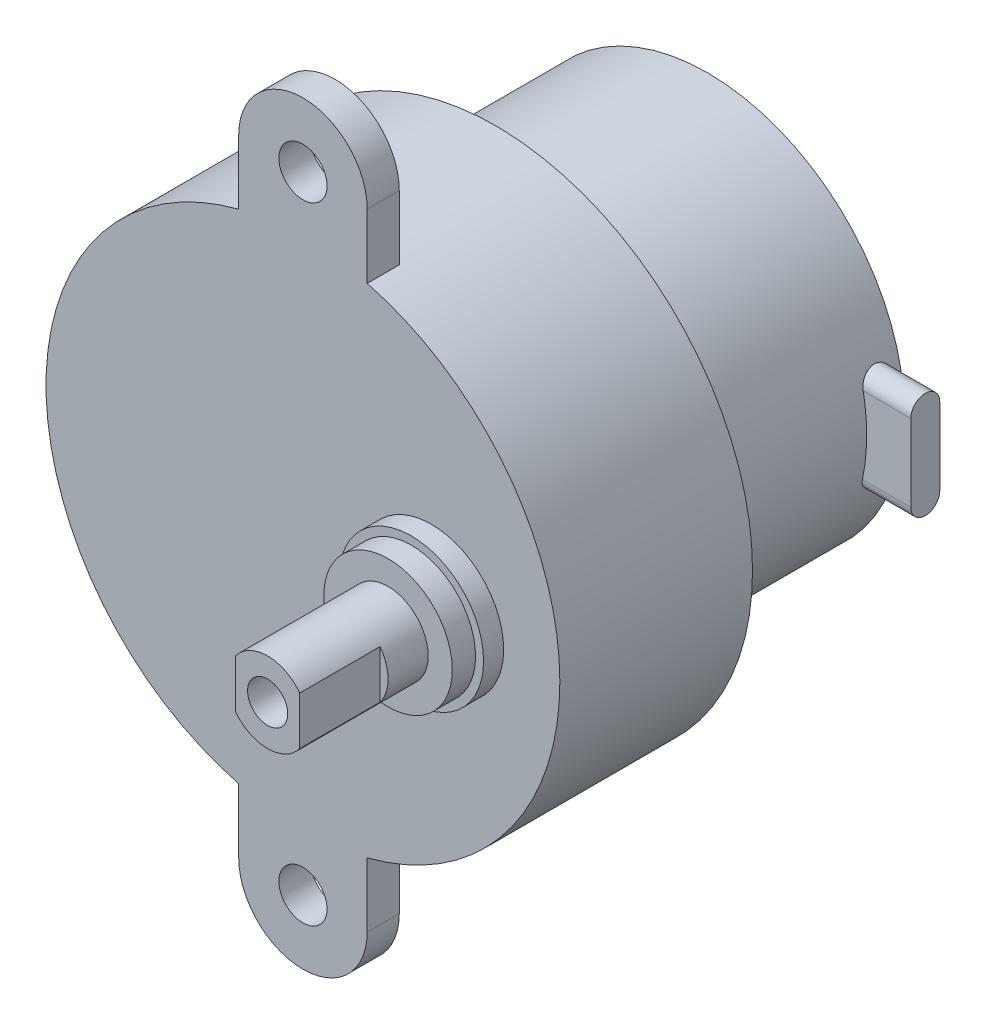
from build123d import *

# Parameters (mm, degrees)
SKETCH_1_R             = 16
EXTRUDE_1_DEPTH        = 12
SKETCH_2_R             = 13
EXTRUDE_2_DEPTH        = 2
SKETCH_3_R             = 12.25
EXTRUDE_4_DEPTH        = 11.2
SKETCH_4_R             = 1.5
EXTRUDE_5_DEPTH        = 2
SKETCH_21_W            = 0.599041837
SKETCH_21_H            = 5.051087673
CUT_EXTRUDE_2_DEPTH    = 5
HOLE_WIZARD_M3_1_D     = 2.5
HOLE_WIZARD_M3_1_DEPTH = 7.5
HOLE_WIZARD_M3_1_TIP   = 0.751075774
EXTRUDE_16_DEPTH       = 15


with BuildPart() as part:
    # 草图1 → 凸台-拉伸1 (new body)
    with BuildSketch(Plane.XY):
        Circle(SKETCH_1_R)
    extrude(amount=-EXTRUDE_1_DEPTH)

    # 草图2 → 凸台-拉伸2 (add)
    with BuildSketch(Plane(origin=(0, 0, -12), x_dir=(-1, 0, 0), z_dir=(0, 0, -1))):
        Circle(SKETCH_2_R)
    extrude(amount=EXTRUDE_2_DEPTH)

    # 草图3 → 凸台-拉伸4 (add)
    with BuildSketch(Plane(origin=(0, 0, -14), x_dir=(-1, 0, 0), z_dir=(0, 0, -1))):
        with Locations(Location((0, 0, 0), (0, 0, 180))):
            Circle(SKETCH_3_R)
    extrude(amount=EXTRUDE_4_DEPTH)

    # 草图4 → 凸台-拉伸5 (add)
    # profile 1 of 2: a face of its own
    with BuildSketch(Plane.XY):
        with BuildLine():
            Line((-4, 19.5), (-4, 15.491933385))
            ThreePointArc((-4, 15.491933385), (0, 16), (4, 15.491933385))
            Line((4, 15.491933385), (4, 19.5))
            ThreePointArc((4, 19.5), (0, 23.5), (-4, 19.5))
        make_face()
        with Locations((0, 19.5)):
            Circle(SKETCH_4_R, mode=Mode.SUBTRACT)
    # profile 2 of 2: a face of its own
    with BuildSketch(Plane.XY):
        with BuildLine():
            Line((-4, -15.491933385), (-4, -19.5))
            ThreePointArc((-4, -19.5), (0, -23.5), (4, -19.5))
            Line((4, -19.5), (4, -15.491933385))
            ThreePointArc((4, -15.491933385), (0, -16), (-4, -15.491933385))
        make_face()
        with Locations(Location((0, -19.5, 0), (0, 0, 180))):
            Circle(SKETCH_4_R, mode=Mode.SUBTRACT)
    extrude(amount=-EXTRUDE_5_DEPTH)

    # 草图17 → 旋转1 (revolve)
    with BuildSketch(Plane(origin=(0, 0, 0), x_dir=(1, 0, 0), z_dir=(0, 1, 0)), mode=Mode.PRIVATE) as revolve_1_sk:
        Polygon((8, -10.2), (8, 0), (3.5, 0), (3.5, -1.25), (4, -1.25), (4, -2.7), (5.5, -2.7), (5.5, -10.2), align=None)
    revolve(revolve_1_sk.sketch.rotate(Axis((8, 0, 10.2), (0, 0, -1)), 180), axis=Axis((8, 0, 10.2), (0, 0, -1)))

    # 草图21 → 切除-拉伸2 (cut)
    with BuildSketch(Plane.XY.offset(10.2)):
        with Locations((5.700479082, -0.105298995)):
            Rectangle(SKETCH_21_W, SKETCH_21_H)
        with Locations((10.299520919, -0.105298995)):
            Rectangle(SKETCH_21_W, SKETCH_21_H)
    extrude(amount=-CUT_EXTRUDE_2_DEPTH, mode=Mode.SUBTRACT)

    # M3 螺纹孔1
    with Locations(Plane.XY.offset(10.2)):
        with Locations((8, 0)):
            Hole(HOLE_WIZARD_M3_1_D / 2, depth=HOLE_WIZARD_M3_1_DEPTH)
            with Locations((0, 0, -(HOLE_WIZARD_M3_1_DEPTH + HOLE_WIZARD_M3_1_TIP / 2))):  # 118° drill point
                Cone(0, HOLE_WIZARD_M3_1_D / 2, HOLE_WIZARD_M3_1_TIP, mode=Mode.SUBTRACT)

    # 草图25 → 凸台-拉伸16 (add)
    with BuildSketch(Plane(origin=(0, 0, 0), x_dir=(0, 0, -1), z_dir=(1, 0, 0))):
        with BuildLine():
            Line((24.65972398, 2.283115818), (24.65972398, -2.515790041))
            ThreePointArc((24.65972398, -2.515790041), (23.758111364, -3.417402657), (22.856498748, -2.515790041))
            Line((22.856498748, -2.515790041), (22.856498748, 2.283115818))
            ThreePointArc((22.856498748, 2.283115818), (23.758111364, 3.184728434), (24.65972398, 2.283115818))
        make_face()
    extrude(amount=EXTRUDE_16_DEPTH)


solid = part.part
